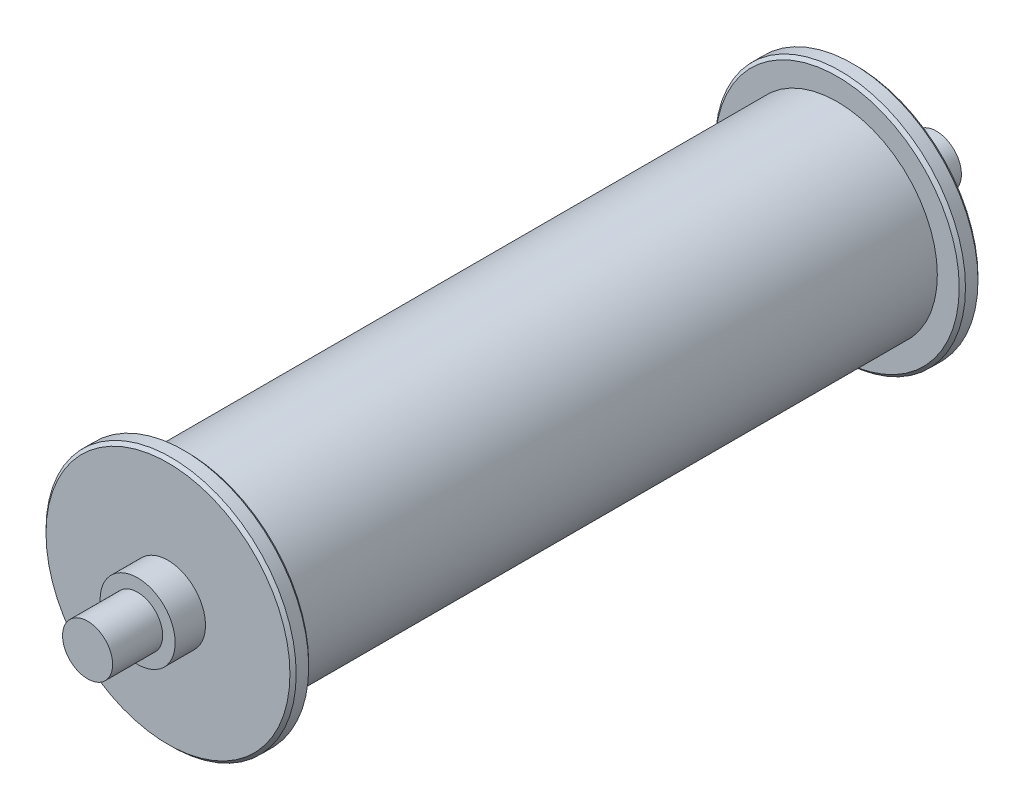
from build123d import *

# Parameters (mm, degrees)
SKETCH1_R           = 20
BOSS_EXTRUDE1_DEPTH = 3
CHAMFER1_SIZE       = 0.5
SKETCH2_R           = 16
BOSS_EXTRUDE2_DEPTH = 104
SKETCH3_R           = 20
BOSS_EXTRUDE3_DEPTH = 3
CHAMFER2_SIZE       = 0.5
SKETCH4_R           = 6
BOSS_EXTRUDE4_DEPTH = 4.85
SKETCH5_R           = 4
BOSS_EXTRUDE5_DEPTH = 8


with BuildPart() as part:
    # Sketch1 → Boss-Extrude1 (new body)
    with BuildSketch(Plane.XY):
        Circle(SKETCH1_R)
    extrude(amount=BOSS_EXTRUDE1_DEPTH)

    # Chamfer1
    chamfer1_edges = [part.edges().sort_by_distance(p)[0] for p in [
        (-20, 0, 0),
        (-20, 0, 3),
    ]]
    chamfer(chamfer1_edges, length=CHAMFER1_SIZE)

    # Sketch2 → Boss-Extrude2 (add)
    with BuildSketch(Plane.XY.offset(3)):
        with Locations(Location((0, 0, 0), (0, 0, 180))):
            Circle(SKETCH2_R)
    extrude(amount=BOSS_EXTRUDE2_DEPTH)

    # Sketch3 → Boss-Extrude3 (add)
    with BuildSketch(Plane.XY.offset(107)):
        Circle(SKETCH3_R)
    extrude(amount=BOSS_EXTRUDE3_DEPTH)

    # Chamfer2
    chamfer2_edges = [part.edges().sort_by_distance(p)[0] for p in [
        (-20, 0, 107),
        (-20, 0, 110),
    ]]
    chamfer(chamfer2_edges, length=CHAMFER2_SIZE)

    # Sketch4 → Boss-Extrude4 (add)
    with BuildSketch(Plane(origin=(0, 0, 0), x_dir=(-1, 0, 0), z_dir=(0, 0, -1))):
        Circle(SKETCH4_R)
    boss_extrude4 = extrude(amount=BOSS_EXTRUDE4_DEPTH)

    # Sketch5 → Boss-Extrude5 (add)
    with BuildSketch(Plane(origin=(0, 0, -4.85), x_dir=(-1, 0, 0), z_dir=(0, 0, -1))):
        Circle(SKETCH5_R)
    boss_extrude5 = extrude(amount=BOSS_EXTRUDE5_DEPTH)

    # Mirror2: Boss-Extrude4, Boss-Extrude5 across plane
    add(boss_extrude4.mirror(Plane(origin=(0, 0, 55), x_dir=(1, 0, 0), z_dir=(0, 0, -1))))
    add(boss_extrude5.mirror(Plane(origin=(0, 0, 55), x_dir=(1, 0, 0), z_dir=(0, 0, -1))))


solid = part.part
